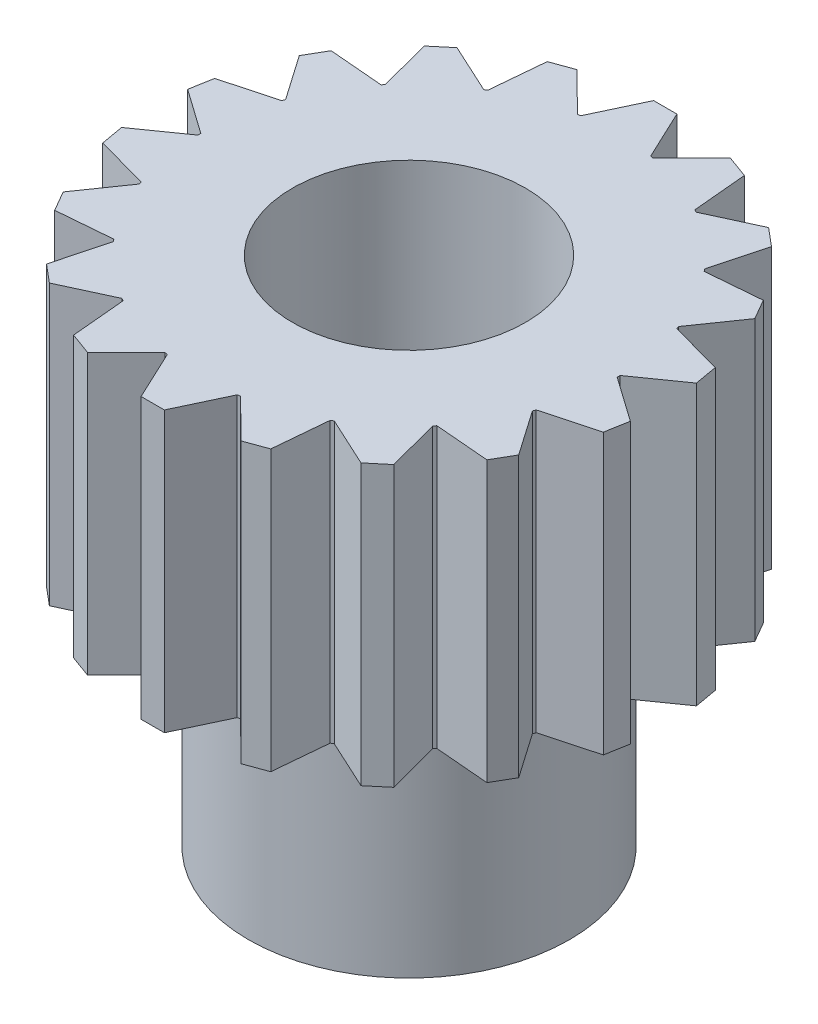
from build123d import *

# Parameters (mm, degrees)
SKETCH1_R           = 2.286
SKETCH1_R_2         = 1.27
BOSS_EXTRUDE1_DEPTH = 3.048
BOSS_EXTRUDE2_START = -3.048
BOSS_EXTRUDE2_DEPTH = 3.048
CIRPATTERN2_COUNT   = 18
BOSS_EXTRUDE3_START = 2.54
SKETCH3_R           = 1.75
SKETCH3_R_2         = 1.27
BOSS_EXTRUDE3_DEPTH = 2.54


with BuildPart() as part:
    # Sketch1 → Boss-Extrude1 (new body)
    with BuildSketch(Plane(origin=(0, 0, 0), x_dir=(1, 0, 0), z_dir=(0, 1, 0))):
        with Locations(Location((0, 0, 0), (0, 0, 90))):
            Circle(SKETCH1_R)
        with Locations(Location((0, 0, 0), (0, 0, 90))):
            Circle(SKETCH1_R_2, mode=Mode.SUBTRACT)
    extrude(amount=BOSS_EXTRUDE1_DEPTH)

    # Sketch2 → Boss-Extrude2 (add)
    with BuildSketch(Plane(origin=(0, 3.048, 0), x_dir=(1, 0, 0), z_dir=(0, 1, 0)).offset(BOSS_EXTRUDE2_START)):
        with BuildLine():
            Line((-0.127, 2.794), (0.127, 2.794))
            Line((0.127, 2.794), (0.381, 2.254026397))
            ThreePointArc((0.381, 2.254026397), (0, 2.286), (-0.381, 2.254026397))
            Line((-0.381, 2.254026397), (-0.127, 2.794))
        make_face()
    boss_extrude2 = extrude(amount=BOSS_EXTRUDE2_DEPTH)

    # CirPattern2: Boss-Extrude2 ×18 about axis
    cirpattern2_axis = Axis((0, 0, 0), (0, 1, 0))
    for i in range(1, CIRPATTERN2_COUNT):
        add(boss_extrude2.rotate(cirpattern2_axis, i * 360 / CIRPATTERN2_COUNT))

    # Sketch3 → Boss-Extrude3 (add)
    with BuildSketch(Plane(origin=(0, 0, 0), x_dir=(-1, 0, 0), z_dir=(0, -1, 0)).offset(BOSS_EXTRUDE3_START)):
        with Locations(Location((0, 0, 0), (0, 0, 270))):
            Circle(SKETCH3_R)
        with Locations(Location((0, 0, 0), (0, 0, 90))):
            Circle(SKETCH3_R_2, mode=Mode.SUBTRACT)
    extrude(amount=-BOSS_EXTRUDE3_DEPTH)


solid = part.part
